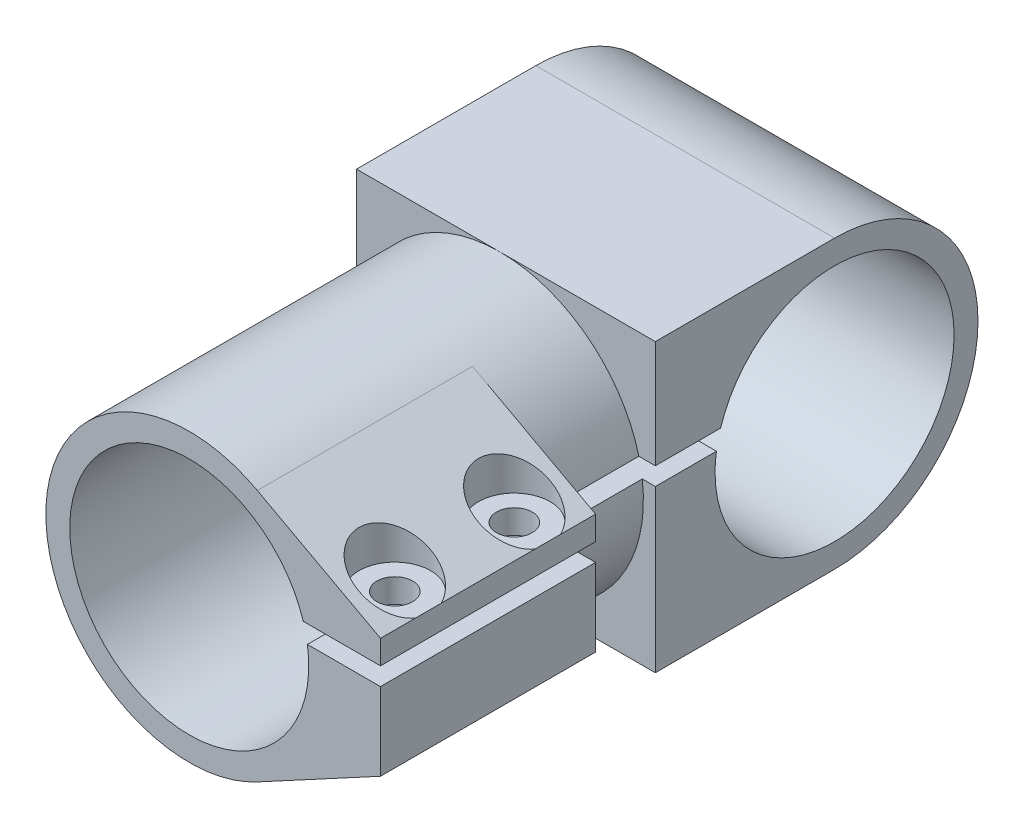
from build123d import *

# Parameters (mm, degrees)
BOSS_EXTRU_1_DEPTH           = 26
BOSS_EXTRU_4_DEPTH           = 25
ESQUISSE5_R                  = 17.691806013
ESQUISSE5_R_2                = 12
ENL_V_MAT_EXTRU_2_DEPTH      = 8
ENL_V_START                  = -2
ESQUISSE6_R                  = 3
ENL_V_MAT_EXTRU_3_DEPTH      = 33.785054262
ESQUISSE7_R                  = 1.5
ENL_V_MAT_EXTRU_4_DEPTH      = 2
ENL_V_MAT_EXTRU_5_DEPTH      = 35.165040612
ENL_V_MAT_EXTRU_5_DEPTH_BACK = 35.165040612
ESQUISSE8_R                  = 1.2
ESQUISSE9_R                  = 10
BOSS_EXTRU_5_DEPTH           = 12.5


with BuildPart() as part:
    # Esquisse1 → Boss.-Extru.1 (new body)
    with BuildSketch(Plane.XY):
        with BuildLine():
            Line((5.700064076, 10.559794957), (16, 5))
            Line((16, 5), (16, 3))
            Line((16, 3), (9.539392014, 3))
            ThreePointArc((9.539392014, 3), (-9.742038622, -2.256697475), (9.886859967, 1.5))
            Line((9.886859967, 1.5), (16, 1.5))
            Line((16, 1.5), (16, -5))
            Line((16, -5), (5.700064076, -10.559794957))
            ThreePointArc((5.700064076, -10.559794957), (-12, 0), (5.700064076, 10.559794957))
        make_face()
    extrude(amount=BOSS_EXTRU_1_DEPTH)

    # Esquisse2 → Boss.-Extru.4 (add)
    with BuildSketch(Plane(origin=(-12, 0, 0), x_dir=(0, 0, -1), z_dir=(1, 0, 0))):
        with BuildLine():
            Line((0, -12), (15, -12))
            ThreePointArc((15, -12), (27, 0), (15, 12))
            Line((15, 12), (0, 12))
            Line((0, 12), (0, 3))
            Line((0, 3), (5.460607986, 3))
            ThreePointArc((5.460607986, 3), (24.742038622, -2.256697475), (5.113140033, 1.5))
            Line((5.113140033, 1.5), (0, 1.5))
            Line((0, 1.5), (0, -12))
        make_face()
    extrude(amount=BOSS_EXTRU_4_DEPTH)

    # Esquisse5 → Enlèv. mat.-Extru.2 (cut)
    with BuildSketch(Plane.XY):
        Circle(ESQUISSE5_R)
        Circle(ESQUISSE5_R_2, mode=Mode.SUBTRACT)
    extrude(amount=ENL_V_MAT_EXTRU_2_DEPTH, mode=Mode.SUBTRACT)

    # Esquisse6 → Enlèv. mat.-Extru.3 (cut, through all)
    with BuildSketch(Plane(origin=(0, 3, 0), x_dir=(-1, 0, 0), z_dir=(0, -1, 0)).offset(ENL_V_START)):
        with Locations((-13.2, -12)):
            Circle(ESQUISSE6_R)
        with Locations((-13.2, -22)):
            Circle(ESQUISSE6_R)
    extrude(amount=-ENL_V_MAT_EXTRU_3_DEPTH, mode=Mode.SUBTRACT)

    # Esquisse7 → Enlèv. mat.-Extru.4 (cut)
    with BuildSketch(Plane(origin=(0, 5, 0), x_dir=(1, 0, 0), z_dir=(0, 1, 0))):
        with Locations(Location((13.2, -12, 0), (0, 0, 270))):
            Circle(ESQUISSE7_R)
        with Locations(Location((13.2, -22, 0), (0, 0, 270))):
            Circle(ESQUISSE7_R)
    extrude(amount=-ENL_V_MAT_EXTRU_4_DEPTH, mode=Mode.SUBTRACT)

    # Esquisse8 → Enlèv. mat.-Extru.5 (cut, two sides: drawn at the far end of the back side and taken through both)
    with BuildSketch(Plane(origin=(0, 1.5, 0), x_dir=(1, 0, 0), z_dir=(0, 1, 0)).offset(-ENL_V_MAT_EXTRU_5_DEPTH_BACK)):
        with Locations((13.2, -12)):
            Circle(ESQUISSE8_R)
        with Locations((13.2, -22)):
            Circle(ESQUISSE8_R)
    extrude(amount=ENL_V_MAT_EXTRU_5_DEPTH + ENL_V_MAT_EXTRU_5_DEPTH_BACK, mode=Mode.SUBTRACT)

    # Esquisse9 → Boss.-Extru.5 (add)
    with BuildSketch(Plane.ZY.offset(12)):
        with BuildLine():
            Line((-15, 12), (0, 12))
            Line((0, 12), (0, -12))
            Line((0, -12), (-15, -12))
            ThreePointArc((-15, -12), (-27, 0), (-15, 12))
        make_face()
        with Locations((-15, 0)):
            Circle(ESQUISSE9_R, mode=Mode.SUBTRACT)
    extrude(amount=-BOSS_EXTRU_5_DEPTH)


solid = part.part
